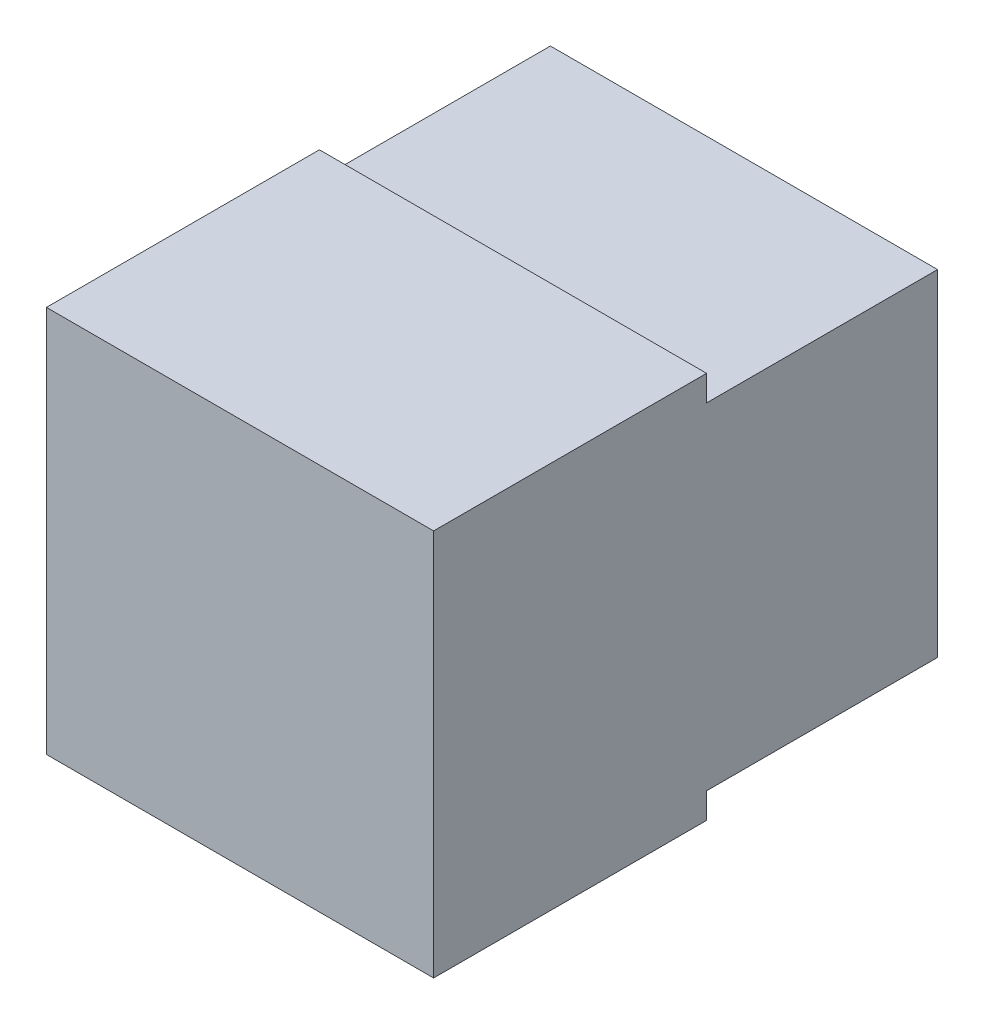
from build123d import *

# Parameters (mm, degrees)
SKETCH1_W           = 46.097722286
SKETCH1_H           = 46.097722286
BOSS_EXTRUDE1_DEPTH = 32.5
SKETCH2_W           = 46.097722286
SKETCH2_H           = 39.997722286
BOSS_EXTRUDE2_DEPTH = 27.5


with BuildPart() as part:
    # Sketch1 → Boss-Extrude1 (new body)
    with BuildSketch(Plane(origin=(0, 0, 0), x_dir=(-1, 0, 0), z_dir=(0, 0, 1))):
        Rectangle(SKETCH1_W, SKETCH1_H)
    extrude(amount=-BOSS_EXTRUDE1_DEPTH)

    # Sketch2 → Boss-Extrude2 (add)
    with BuildSketch(Plane(origin=(0, 0, -32.5), x_dir=(-1, 0, 0), z_dir=(0, 0, -1))):
        Rectangle(SKETCH2_W, SKETCH2_H)
    extrude(amount=BOSS_EXTRUDE2_DEPTH)


solid = part.part
